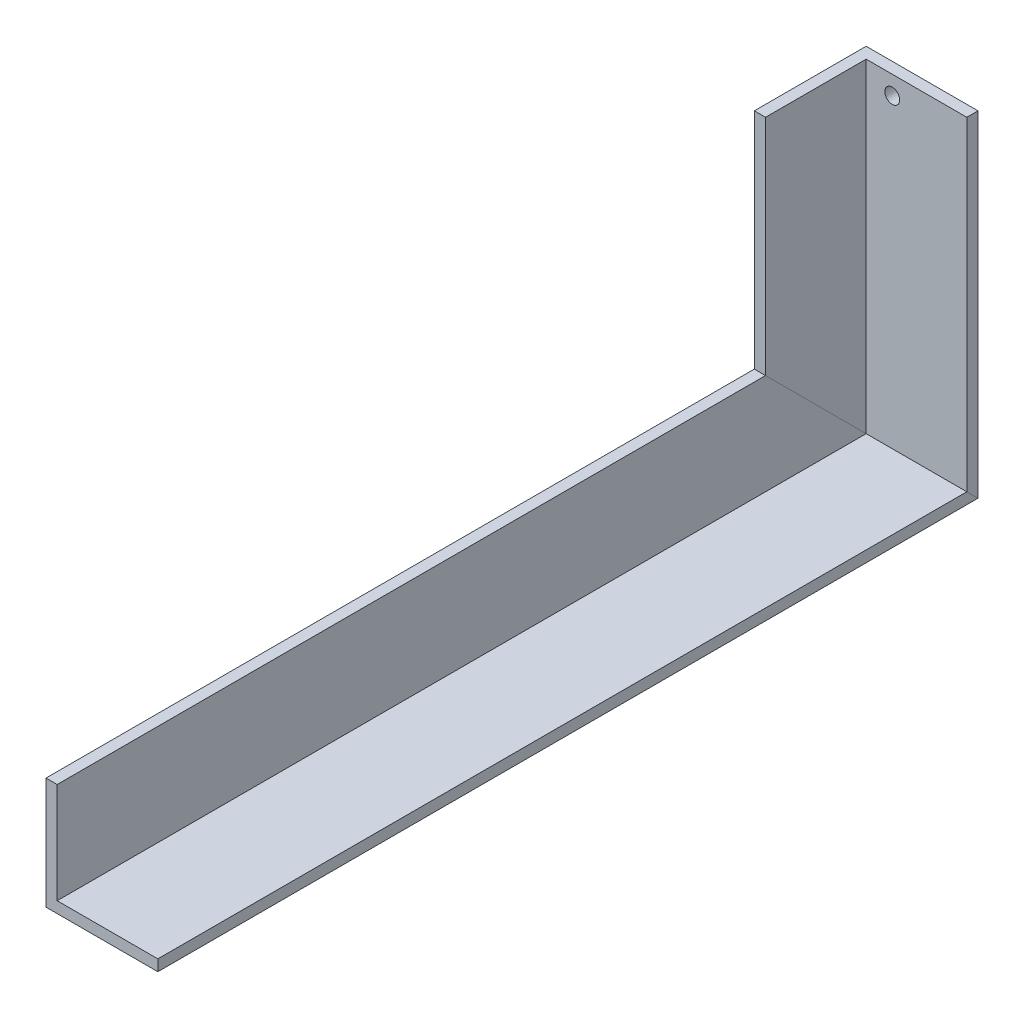
from build123d import *

# Parameters (mm, degrees)
SKETCH13_R         = 2
CUT_EXTRUDE1_DEPTH = 10


with BuildPart() as part:
    # Sweep1: sweep along a path in Sketch4
    with BuildLine(Plane(origin=(0, 0, 0), x_dir=(0, 0, -1), z_dir=(1, 0, 0))) as sweep1_path:
        Line((0, 0), (220, 0))
        Line((220, 0), (220, 90))
    # Sketch2 → Sweep1 (sweep)
    with BuildSketch(Plane.XY):
        Polygon((0, 0), (30, 0), (30, 3), (3, 3), (3, 30), (0, 30), align=None)
    sweep(path=sweep1_path.line, transition=Transition.RIGHT)

    # Sketch13 → Cut-Extrude1 (cut)
    with BuildSketch(Plane(origin=(0, 0, -220), x_dir=(-1, 0, 0), z_dir=(0, 0, -1))):
        with Locations((-10, 85)):
            Circle(SKETCH13_R)
    extrude(amount=-CUT_EXTRUDE1_DEPTH, mode=Mode.SUBTRACT)


solid = part.part
